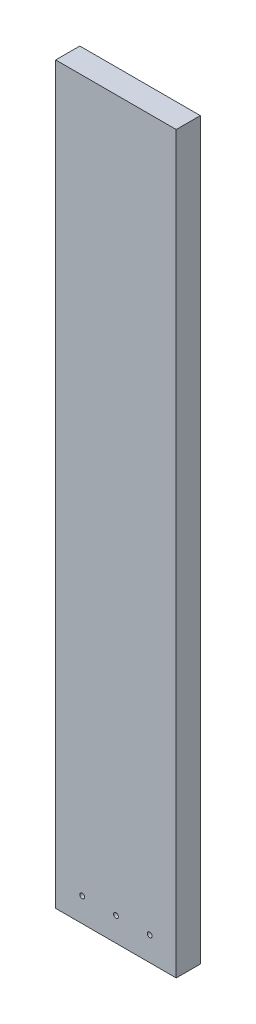
from build123d import *

# Parameters (mm, degrees)
SKETCH1_W           = 50
SKETCH1_H           = 304.8
SKETCH1_R           = 1
BOSS_EXTRUDE1_DEPTH = 10


with BuildPart() as part:
    # Sketch1 → Boss-Extrude1 (new body)
    with BuildSketch(Plane.XY):
        Rectangle(SKETCH1_W, SKETCH1_H)
        with Locations((-14, -142.4)):
            Circle(SKETCH1_R, mode=Mode.SUBTRACT)
        with Locations((0, -142.4)):
            Circle(SKETCH1_R, mode=Mode.SUBTRACT)
        with Locations((14, -142.4)):
            Circle(SKETCH1_R, mode=Mode.SUBTRACT)
    extrude(amount=BOSS_EXTRUDE1_DEPTH)


solid = part.part
